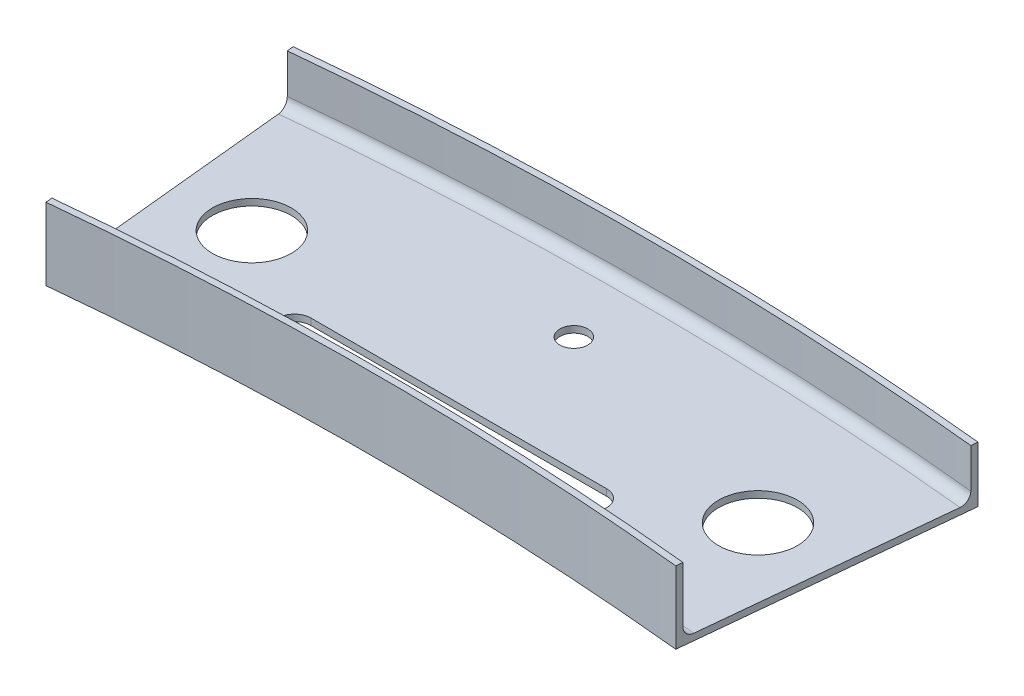
from build123d import *

# Parameters (mm, degrees)
MOUNTING_POINTS_DEPTH      = 116.951759253
MOUNTING_POINTS_DEPTH_BACK = 116.951759253
SKETCH3_R                  = 4.25
SKETCH3_R_2                = 12
SLOT_CLEARANCE_DEPTH       = 116.951759253
SLOT_CLEARANCE_DEPTH_BACK  = 116.951759253


with BuildPart() as part:
    # Sweep1: sweep along a path in Sketch1
    with BuildLine(Plane(origin=(0, 0, 0), x_dir=(1, 0, 0), z_dir=(0, 1, 0))) as sweep1_path:
        ThreePointArc((-100, -5), (0, 0), (100, -5))
    # Sketch2 → Sweep1 (sweep)
    with BuildSketch(Plane(origin=(0, 0, 0), x_dir=(0, 0, -1), z_dir=(1, 0, 0))):
        with BuildLine():
            Line((-37, 0), (37, 0))
            ThreePointArc((37, 0), (39.121320344, 0.878679656), (40, 3))
            Line((40, 3), (40, 15))
            Line((40, 15), (42, 15))
            Line((42, 15), (42, -2))
            Line((42, -2), (-42, -2))
            Line((-42, -2), (-42, 20))
            Line((-42, 20), (-40, 20))
            Line((-40, 20), (-40, 3))
            ThreePointArc((-40, 3), (-39.121320344, 0.878679656), (-37, 0))
        make_face()
    sweep(path=sweep1_path.line)

    # Sketch3 → Mounting points (cut, two sides: drawn at the far end of the back side and taken through both)
    with BuildSketch(Plane(origin=(0, 0, 0), x_dir=(1, 0, 0), z_dir=(0, 1, 0)).offset(-MOUNTING_POINTS_DEPTH_BACK)):
        with Locations(Location((0, 18, 0), (0, 0, 270))):
            Circle(SKETCH3_R)
        with Locations(Location((-77, -2.961481483, 0), (0, 0, 270))):
            Circle(SKETCH3_R_2)
        with Locations(Location((77, -2.961481483, 0), (0, 0, 270))):
            Circle(SKETCH3_R_2)
    extrude(amount=MOUNTING_POINTS_DEPTH + MOUNTING_POINTS_DEPTH_BACK, mode=Mode.SUBTRACT)

    # Sketch4 → Slot clearance (cut, two sides: drawn at the far end of the back side and taken through both)
    with BuildSketch(Plane(origin=(0, 0, 0), x_dir=(1, 0, 0), z_dir=(0, 1, 0)).offset(-SLOT_CLEARANCE_DEPTH_BACK)):
        with BuildLine():
            Line((-45, -17), (45, -17))
            ThreePointArc((45, -17), (50, -22), (45, -27))
            Line((45, -27), (-45, -27))
            ThreePointArc((-45, -27), (-50, -22), (-45, -17))
        make_face()
    extrude(amount=SLOT_CLEARANCE_DEPTH + SLOT_CLEARANCE_DEPTH_BACK, mode=Mode.SUBTRACT)


solid = part.part
